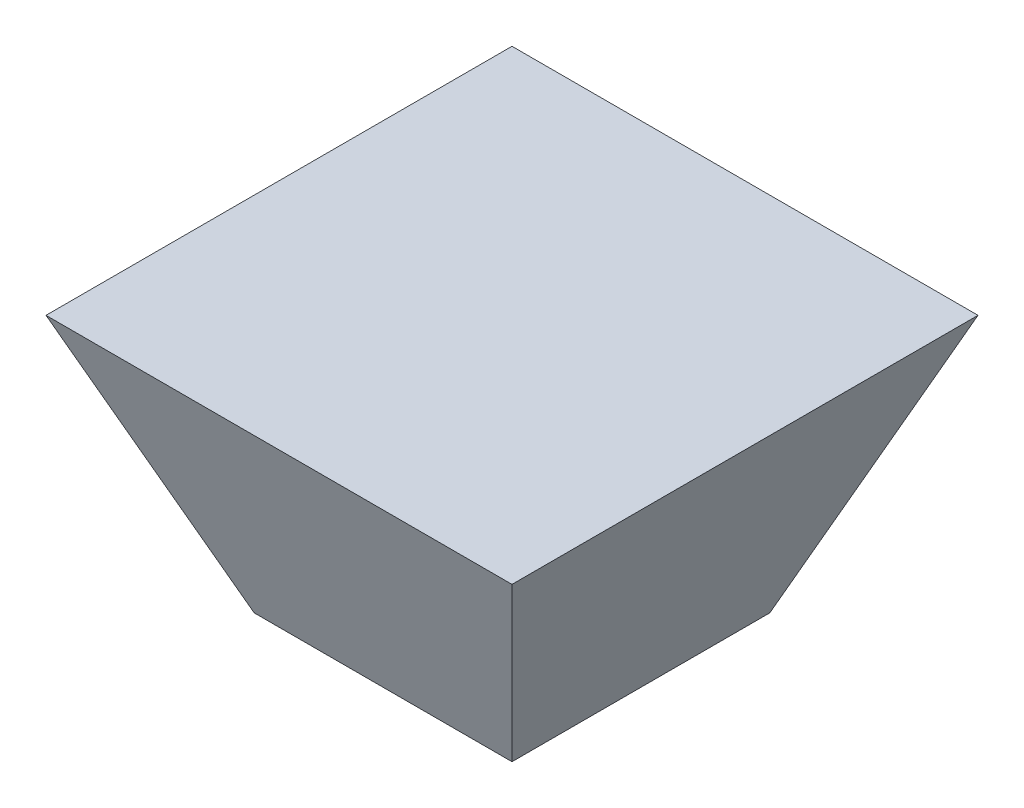
from build123d import *

# Parameters (mm, degrees)
SKETCH1_W           = 112.7
SKETCH1_H           = 112.7
BOSS_EXTRUDE2_DEPTH = 112.7
BOSS_EXTRUDE2_DRAFT = -22


with BuildPart() as part:
    # Sketch1 → Boss-Extrude2 (with draft: the straight prism first)
    with BuildSketch(Plane(origin=(0, 0, 0), x_dir=(1, 0, 0), z_dir=(0, 1, 0))):
        Rectangle(SKETCH1_W, SKETCH1_H)
    extrude(amount=BOSS_EXTRUDE2_DEPTH)
    # Boss-Extrude2: the draft: its side faces are tilted about the plane it starts from
    boss_extrude2_sides = [part.faces().sort_by_distance(p)[0] for p in [
        (-56.35, 56.35, 0),
        (0, 56.35, 56.35),
        (56.35, 56.35, 0),
        (0, 56.35, -56.35),
    ]]
    draft(boss_extrude2_sides, Plane(origin=(0, 0, 0), x_dir=(1, 0, 0), z_dir=(0, 1, 0)), BOSS_EXTRUDE2_DRAFT)


solid = part.part
